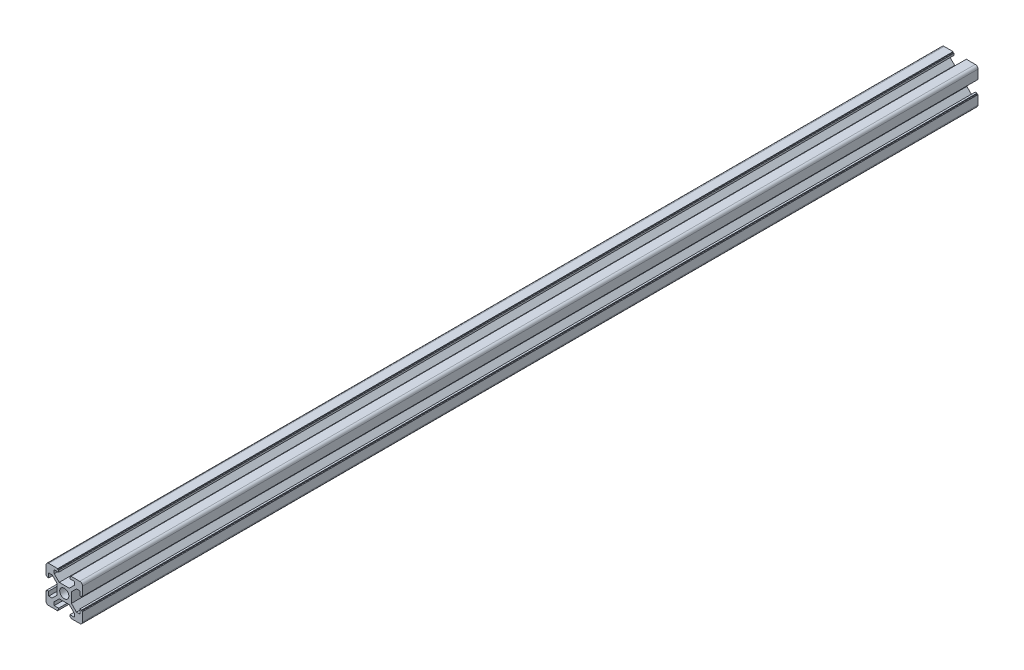
from build123d import *

# Parameters (mm, degrees)
SKETCH1_R           = 2.5
EXTRUDE_1_DEPTH     = 490
SKETCH_1_R          = 1.7
CUT_EXTRUDE_2_DEPTH = 491.299102589


with BuildPart() as part:
    # Sketch1 → 凸台-拉伸1 (new body)
    with BuildSketch(Plane.XY):
        with BuildLine():
            Line((-3.6, 10), (-3.6, 9.5))
            Line((-3.6, 9.5), (-3.1, 9.5))
            Line((-3.1, 9.5), (-3.1, 8.5))
            Line((-3.1, 8.5), (-5.5, 8.5))
            Line((-5.5, 8.5), (-5.5, 6.65))
            Line((-5.5, 6.65), (-2.75, 3.9))
            Line((-2.75, 3.9), (2.75, 3.9))
            Line((2.75, 3.9), (5.5, 6.65))
            Line((5.5, 6.65), (5.5, 8.5))
            Line((5.5, 8.5), (3.1, 8.5))
            Line((3.1, 8.5), (3.1, 9.5))
            Line((3.1, 9.5), (3.6, 9.5))
            Line((3.6, 9.5), (3.6, 10))
            Line((3.6, 10), (8.5, 10))
            ThreePointArc((8.5, 10), (9.560660172, 9.560660172), (10, 8.5))
            Line((10, 8.5), (10, 3.6))
            Line((10, 3.6), (9.5, 3.6))
            Line((9.5, 3.6), (9.5, 3.1))
            Line((9.5, 3.1), (8.5, 3.1))
            Line((8.5, 3.1), (8.5, 5.5))
            Line((8.5, 5.5), (6.65, 5.5))
            Line((6.65, 5.5), (3.9, 2.75))
            Line((3.9, 2.75), (3.9, -2.75))
            Line((3.9, -2.75), (6.65, -5.5))
            Line((6.65, -5.5), (8.5, -5.5))
            Line((8.5, -5.5), (8.5, -3.1))
            Line((8.5, -3.1), (9.5, -3.1))
            Line((9.5, -3.1), (9.5, -3.6))
            Line((9.5, -3.6), (10, -3.6))
            Line((10, -3.6), (10, -8.5))
            ThreePointArc((10, -8.5), (9.560660172, -9.560660172), (8.5, -10))
            Line((8.5, -10), (3.6, -10))
            Line((3.6, -10), (3.6, -9.5))
            Line((3.6, -9.5), (3.1, -9.5))
            Line((3.1, -9.5), (3.1, -8.5))
            Line((3.1, -8.5), (5.5, -8.5))
            Line((5.5, -8.5), (5.5, -6.65))
            Line((5.5, -6.65), (2.75, -3.9))
            Line((2.75, -3.9), (-2.75, -3.9))
            Line((-2.75, -3.9), (-5.5, -6.65))
            Line((-5.5, -6.65), (-5.5, -8.5))
            Line((-5.5, -8.5), (-3.1, -8.5))
            Line((-3.1, -8.5), (-3.1, -9.5))
            Line((-3.1, -9.5), (-3.6, -9.5))
            Line((-3.6, -9.5), (-3.6, -10))
            Line((-3.6, -10), (-8.5, -10))
            ThreePointArc((-8.5, -10), (-9.560660172, -9.560660172), (-10, -8.5))
            Line((-10, -8.5), (-10, -3.6))
            Line((-10, -3.6), (-9.5, -3.6))
            Line((-9.5, -3.6), (-9.5, -3.1))
            Line((-9.5, -3.1), (-8.5, -3.1))
            Line((-8.5, -3.1), (-8.5, -5.5))
            Line((-8.5, -5.5), (-6.65, -5.5))
            Line((-6.65, -5.5), (-3.9, -2.75))
            Line((-3.9, -2.75), (-3.9, 2.75))
            Line((-3.9, 2.75), (-6.65, 5.5))
            Line((-6.65, 5.5), (-8.5, 5.5))
            Line((-8.5, 5.5), (-8.5, 3.1))
            Line((-8.5, 3.1), (-9.5, 3.1))
            Line((-9.5, 3.1), (-9.5, 3.6))
            Line((-9.5, 3.6), (-10, 3.6))
            Line((-10, 3.6), (-10, 8.5))
            ThreePointArc((-10, 8.5), (-9.560660172, 9.560660172), (-8.5, 10))
            Line((-8.5, 10), (-3.6, 10))
        make_face()
        Circle(SKETCH1_R, mode=Mode.SUBTRACT)
    extrude(amount=EXTRUDE_1_DEPTH)

    # 草图1 → 切除-拉伸2 (cut, through all)
    with BuildSketch(Plane(origin=(0, 3.9, 0), x_dir=(1, 0, 0), z_dir=(0, 1, 0))):
        with Locations(Location((0, -460, 0), (0, 0, 180))):
            Circle(SKETCH_1_R)
        with Locations(Location((0, -441, 0), (0, 0, 180))):
            Circle(SKETCH_1_R)
    extrude(amount=-CUT_EXTRUDE_2_DEPTH, mode=Mode.SUBTRACT)


solid = part.part
